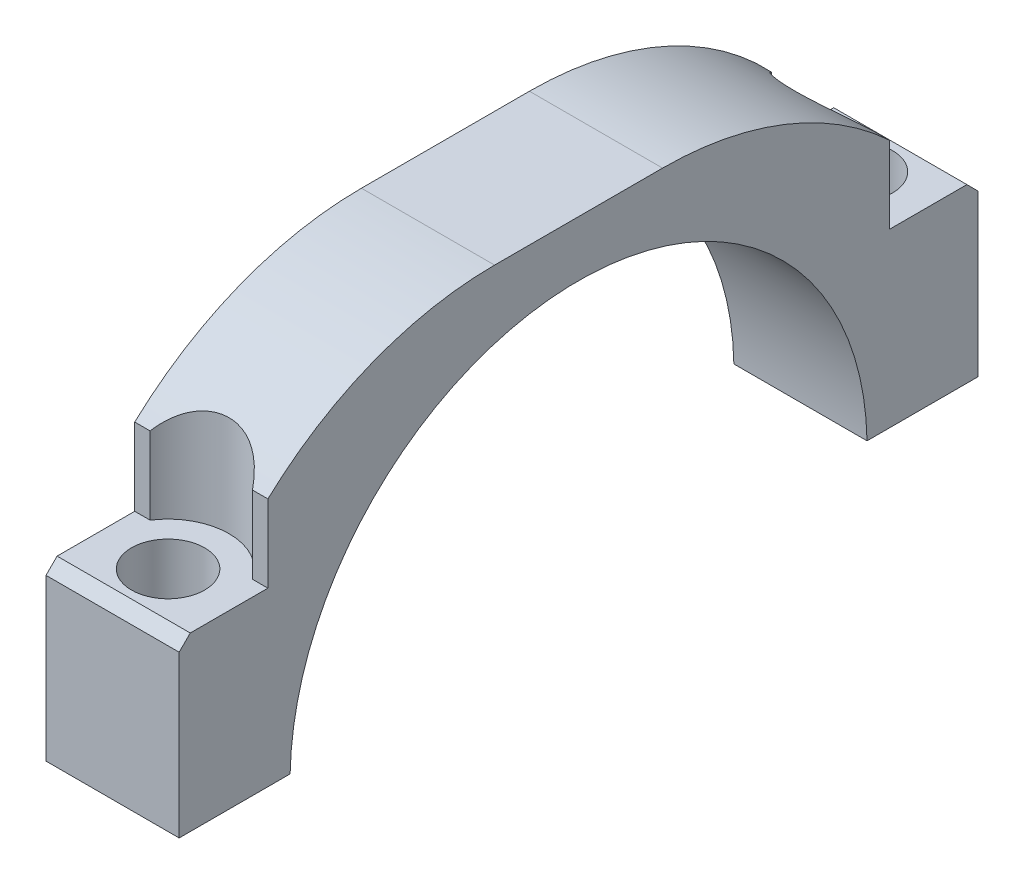
from build123d import *

# Parameters (mm, degrees)
BOSS_EXTRUDE1_DEPTH  = 12
CHAMFER1_SIZE        = 16
FILLET1_R            = 30
M6_CLEARANCE_HOLE1_D = 6.6
SKETCH4_R            = 5.5
CUT_EXTRUDE1_DEPTH   = 15
SKETCH5_W            = 23.874068734
SKETCH5_H            = 12.946873537
CUT_EXTRUDE2_DEPTH   = 15


with BuildPart() as part:
    # Sketch1 → Boss-Extrude1 (new body)
    with BuildSketch(Plane(origin=(0, 0, 0), x_dir=(0, 0, -1), z_dir=(1, 0, 0))):
        with BuildLine():
            Line((-35.995191863, 0), (35.995191863, 0))
            Line((35.995191863, 0), (35.995191863, -30.5))
            Line((35.995191863, -30.5), (25.995191863, -30.5))
            ThreePointArc((25.995191863, -30.5), (0, -5), (-25.995191863, -30.5))
            Line((-25.995191863, -30.5), (-35.995191863, -30.5))
            Line((-35.995191863, -30.5), (-35.995191863, 0))
        make_face()
    extrude(amount=BOSS_EXTRUDE1_DEPTH)

    # Chamfer1
    chamfer1_edges = [part.edges().sort_by_distance(p)[0] for p in [
        (6, 0, 35.995191863),
        (6, 0, -35.995191863),
    ]]
    chamfer(chamfer1_edges, length=CHAMFER1_SIZE)

    # Fillet1
    fillet1_edges = [part.edges().sort_by_distance(p)[0] for p in [
        (6, 0, 19.995191863),
        (6, 0, -19.995191863),
    ]]
    fillet(fillet1_edges, radius=FILLET1_R)

    # M6 Clearance Hole1 (through all)
    with Locations(Plane(origin=(0, -30.5, 0), x_dir=(-1, 0, 0), z_dir=(0, -1, 0))):
        with Locations((-6, -30.995191863), (-6, 30.995191863)):
            Hole(M6_CLEARANCE_HOLE1_D / 2)

    # Sketch4 → Cut-Extrude1 (cut)
    with BuildSketch(Plane(origin=(0, 0, 0), x_dir=(1, 0, 0), z_dir=(0, 1, 0))):
        with Locations((6, -30.995191863)):
            Circle(SKETCH4_R)
        with Locations((6, 30.995191863)):
            Circle(SKETCH4_R)
    extrude(amount=-CUT_EXTRUDE1_DEPTH, mode=Mode.SUBTRACT)

    # Sketch5 → Cut-Extrude2 (cut)
    with BuildSketch(Plane(origin=(0, 0, 0), x_dir=(1, 0, 0), z_dir=(0, 1, 0))):
        with Locations((6, -34.473436769)):
            Rectangle(SKETCH5_W, SKETCH5_H)
        with Locations((6, 34.473436769)):
            Rectangle(SKETCH5_W, SKETCH5_H)
    extrude(amount=-CUT_EXTRUDE2_DEPTH, mode=Mode.SUBTRACT)


solid = part.part
